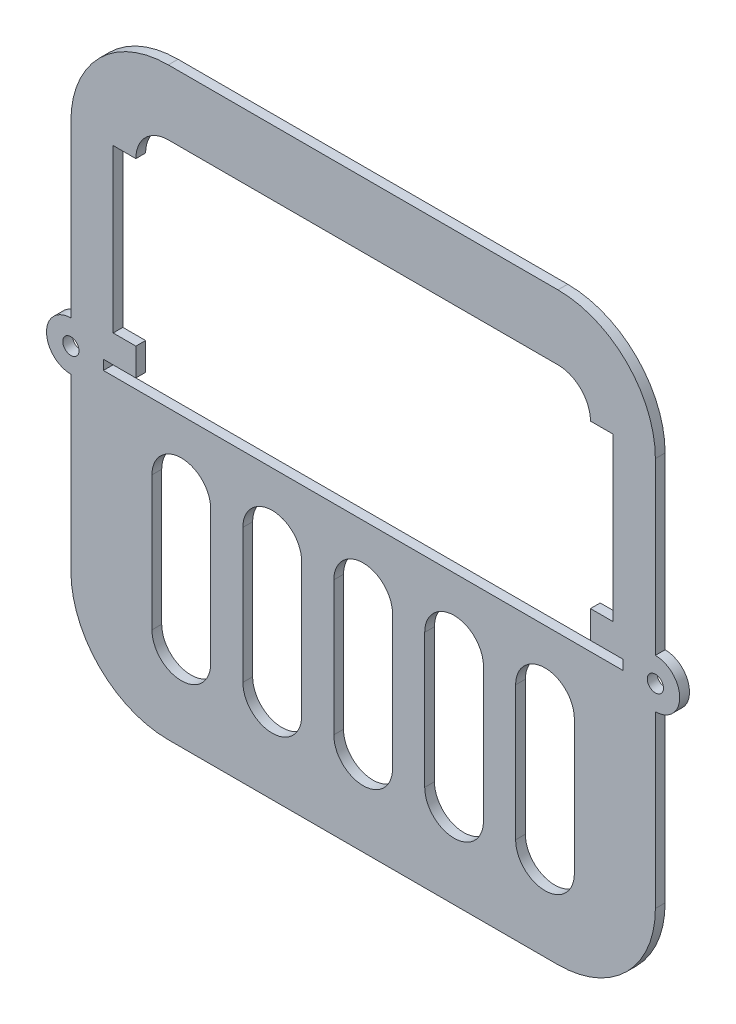
from build123d import *

# Parameters (mm, degrees)
SKETCH1_R           = 2.5
BOSS_EXTRUDE1_DEPTH = 3


with BuildPart() as part:
    # Sketch1 → Boss-Extrude1 (new body)
    with BuildSketch(Plane.XY):
        with BuildLine():
            Line((167.77621964, -174.96032759), (287.77621964, -174.96032759))
            ThreePointArc((287.77621964, -174.96032759), (308.989423075, -166.173531026), (317.77621964, -144.96032759))
            Line((317.77621964, -144.96032759), (317.77621964, -92.46032759))
            ThreePointArc((317.77621964, -92.46032759), (325.27621964, -84.96032759), (317.77621964, -77.46032759))
            Line((317.77621964, -77.46032759), (317.77621964, -24.96032759))
            ThreePointArc((317.77621964, -24.96032759), (308.989423075, -3.747124154), (287.77621964, 5.03967241))
            Line((287.77621964, 5.03967241), (167.77621964, 5.03967241))
            ThreePointArc((167.77621964, 5.03967241), (146.563016204, -3.747124154), (137.77621964, -24.96032759))
            Line((137.77621964, -24.96032759), (137.77621964, -77.46032759))
            ThreePointArc((137.77621964, -77.46032759), (130.27621964, -84.96032759), (137.77621964, -92.46032759))
            Line((137.77621964, -92.46032759), (137.77621964, -144.96032759))
            ThreePointArc((137.77621964, -144.96032759), (146.563016204, -166.173531026), (167.77621964, -174.96032759))
        make_face()
        with Locations((317.77621964, -84.96032759)):
            Circle(SKETCH1_R, mode=Mode.SUBTRACT)
        with Locations((137.77621964, -84.96032759)):
            Circle(SKETCH1_R, mode=Mode.SUBTRACT)
        with BuildLine():
            Line((226.284678956, -14.96032759), (167.784678956, -14.96032759))
            ThreePointArc((167.784678956, -14.96032759), (160.713611144, -17.889259778), (157.784678956, -24.96032759))
            Line((157.784678956, -24.96032759), (150.784678956, -24.96032759))
            Line((150.784678956, -24.96032759), (150.784678956, -74.96032759))
            Line((150.784678956, -74.96032759), (157.784678956, -74.96032759))
            Line((157.784678956, -74.96032759), (157.784678956, -83.46032759))
            Line((157.784678956, -83.46032759), (147.784678956, -83.46032759))
            Line((147.784678956, -83.46032759), (147.784678956, -86.46032759))
            Line((147.784678956, -86.46032759), (157.784678956, -86.46032759))
            Line((157.784678956, -86.46032759), (297.784678956, -86.46032759))
            Line((297.784678956, -86.46032759), (307.784678956, -86.46032759))
            Line((307.784678956, -86.46032759), (307.784678956, -83.46032759))
            Line((307.784678956, -83.46032759), (297.784678956, -83.46032759))
            Line((297.784678956, -83.46032759), (297.784678956, -74.96032759))
            Line((297.784678956, -74.96032759), (304.784678956, -74.96032759))
            Line((304.784678956, -74.96032759), (304.784678956, -24.96032759))
            Line((304.784678956, -24.96032759), (297.784678956, -24.96032759))
            ThreePointArc((297.784678956, -24.96032759), (294.855746768, -17.889259778), (287.784678956, -14.96032759))
            Line((287.784678956, -14.96032759), (229.284678956, -14.96032759))
            Line((229.284678956, -14.96032759), (226.284678956, -14.96032759))
        make_face(mode=Mode.SUBTRACT)
        with BuildLine():
            Line((246.743573739, -106.823862957), (246.743573739, -148.163900951))
            ThreePointArc((246.743573739, -148.163900951), (255.784678956, -157.205006168), (264.825784173, -148.163900951))
            Line((264.825784173, -148.163900951), (264.825784173, -106.823862957))
            ThreePointArc((264.825784173, -106.823862957), (255.784678956, -97.78275774), (246.743573739, -106.823862957))
        make_face(mode=Mode.SUBTRACT)
        with BuildLine():
            Line((236.825784173, -106.823862957), (236.825784173, -148.163900951))
            ThreePointArc((236.825784173, -148.163900951), (227.784678956, -157.205006168), (218.743573739, -148.163900951))
            Line((218.743573739, -148.163900951), (218.743573739, -106.823862957))
            ThreePointArc((218.743573739, -106.823862957), (227.784678956, -97.78275774), (236.825784173, -106.823862957))
        make_face(mode=Mode.SUBTRACT)
        with BuildLine():
            Line((274.743573739, -106.823862957), (274.743573739, -148.163900951))
            ThreePointArc((274.743573739, -148.163900951), (283.784678956, -157.205006168), (292.825784173, -148.163900951))
            Line((292.825784173, -148.163900951), (292.825784173, -106.823862957))
            ThreePointArc((292.825784173, -106.823862957), (283.784678956, -97.78275774), (274.743573739, -106.823862957))
        make_face(mode=Mode.SUBTRACT)
        with BuildLine():
            Line((190.743573739, -106.823862957), (190.743573739, -148.163900951))
            ThreePointArc((190.743573739, -148.163900951), (199.784678956, -157.205006168), (208.825784173, -148.163900951))
            Line((208.825784173, -148.163900951), (208.825784173, -106.823862957))
            ThreePointArc((208.825784173, -106.823862957), (199.784678956, -97.78275774), (190.743573739, -106.823862957))
        make_face(mode=Mode.SUBTRACT)
        with BuildLine():
            Line((162.743573739, -106.823862957), (162.743573739, -148.163900951))
            ThreePointArc((162.743573739, -148.163900951), (171.784678956, -157.205006168), (180.825784173, -148.163900951))
            Line((180.825784173, -148.163900951), (180.825784173, -106.823862957))
            ThreePointArc((180.825784173, -106.823862957), (171.784678956, -97.78275774), (162.743573739, -106.823862957))
        make_face(mode=Mode.SUBTRACT)
    extrude(amount=BOSS_EXTRUDE1_DEPTH)


solid = part.part
